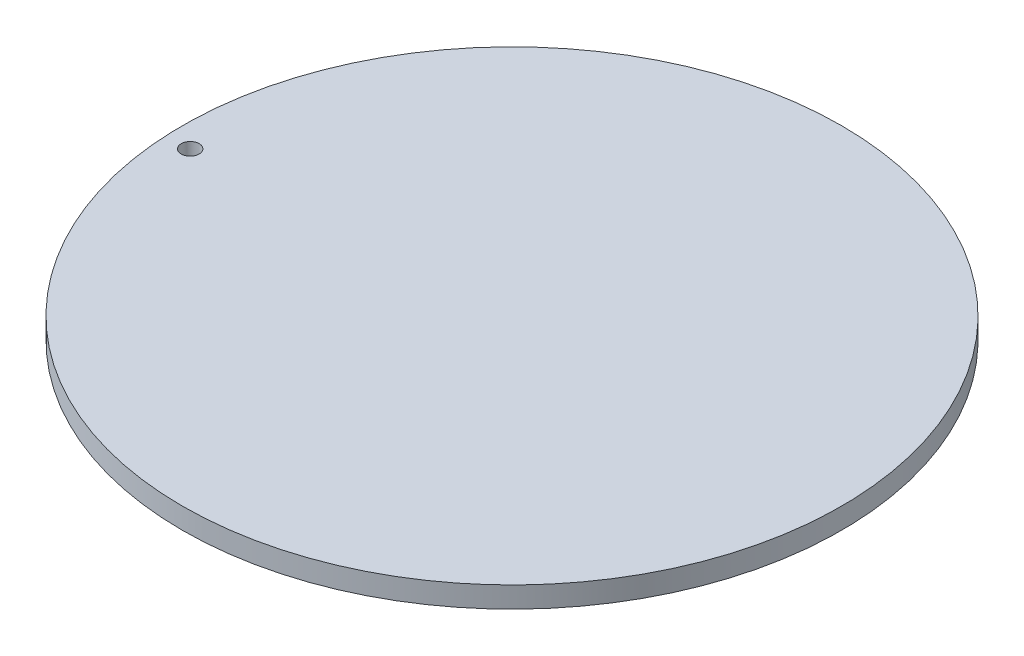
from build123d import *

# Parameters (mm, degrees)
ESQUISSE1_W             = 110
ESQUISSE1_H             = 7
ESQUISSE6_R             = 3
ENL_V_MAT_EXTRU_1_DEPTH = 10


with BuildPart() as part:
    # Esquisse1 → Révolution1 (revolve)
    with BuildSketch(Plane.XY, mode=Mode.PRIVATE) as r_volution1_sk:
        with Locations((55, 0.85178262)):
            Rectangle(ESQUISSE1_W, ESQUISSE1_H)
    revolve(r_volution1_sk.sketch.rotate(Axis((0, 25.13303262, 0), (0, -1, 0)), 90), axis=Axis((0, 25.13303262, 0), (0, -1, 0)))

    # Esquisse6 → Enlèv. mat.-Extru.1 (cut)
    with BuildSketch(Plane(origin=(0, 4.35178262, 0), x_dir=(1, 0, 0), z_dir=(0, 1, 0))):
        with Locations(Location((-102, -5.415123159, 0), (0, 0, 270))):
            Circle(ESQUISSE6_R)
    extrude(amount=-ENL_V_MAT_EXTRU_1_DEPTH, mode=Mode.SUBTRACT)


solid = part.part
